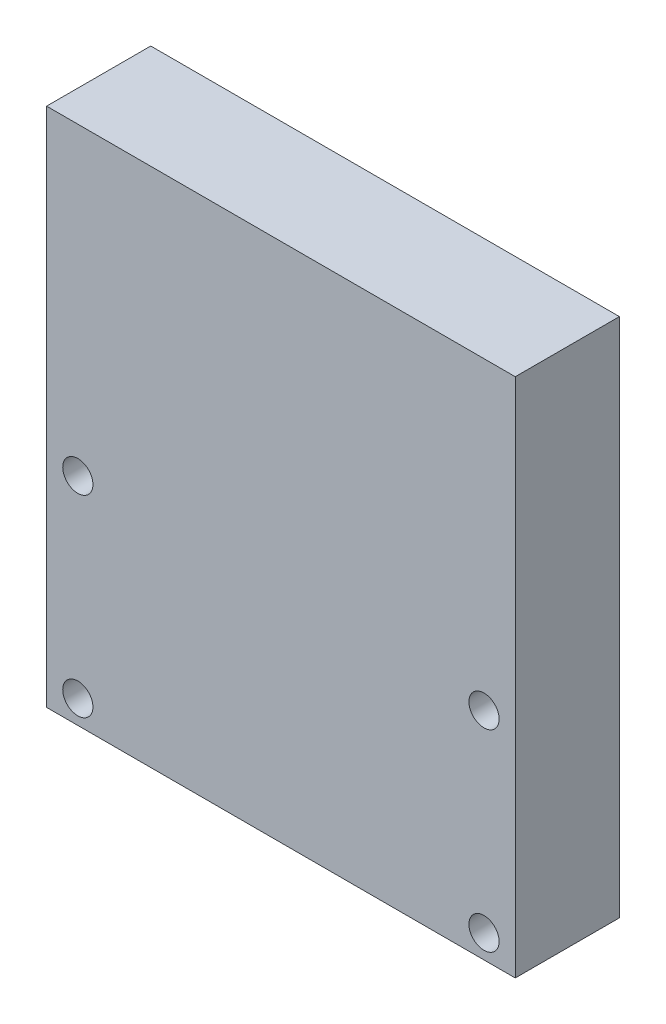
from build123d import *

# Parameters (mm, degrees)
SKETCH2_W           = 45
SKETCH2_H           = 10
BOSS_EXTRUDE1_DEPTH = 40
SKETCH3_R           = 1.45
CUT_EXTRUDE1_DEPTH  = 40
SKETCH4_W           = 45
SKETCH4_H           = 10
BOSS_EXTRUDE2_DEPTH = 10


with BuildPart() as part:
    # Sketch2 → Boss-Extrude1 (new body)
    with BuildSketch(Plane(origin=(0, 0, 0), x_dir=(1, 0, 0), z_dir=(0, 1, 0))):
        Rectangle(SKETCH2_W, SKETCH2_H)
    extrude(amount=BOSS_EXTRUDE1_DEPTH)

    # Sketch3 → Cut-Extrude1 (cut)
    with BuildSketch(Plane(origin=(0, 0, -5), x_dir=(-1, 0, 0), z_dir=(0, 0, -1))):
        with Locations((19.5, 2.25)):
            Circle(SKETCH3_R)
        with Locations((-19.5, 2.25)):
            Circle(SKETCH3_R)
        with Locations((-19.5, 20.75)):
            Circle(SKETCH3_R)
        with Locations((19.5, 20.75)):
            Circle(SKETCH3_R)
    extrude(amount=-CUT_EXTRUDE1_DEPTH, mode=Mode.SUBTRACT)

    # Sketch4 → Boss-Extrude2 (add)
    with BuildSketch(Plane(origin=(0, 40, 0), x_dir=(1, 0, 0), z_dir=(0, 1, 0))):
        Rectangle(SKETCH4_W, SKETCH4_H)
    extrude(amount=BOSS_EXTRUDE2_DEPTH)


solid = part.part
